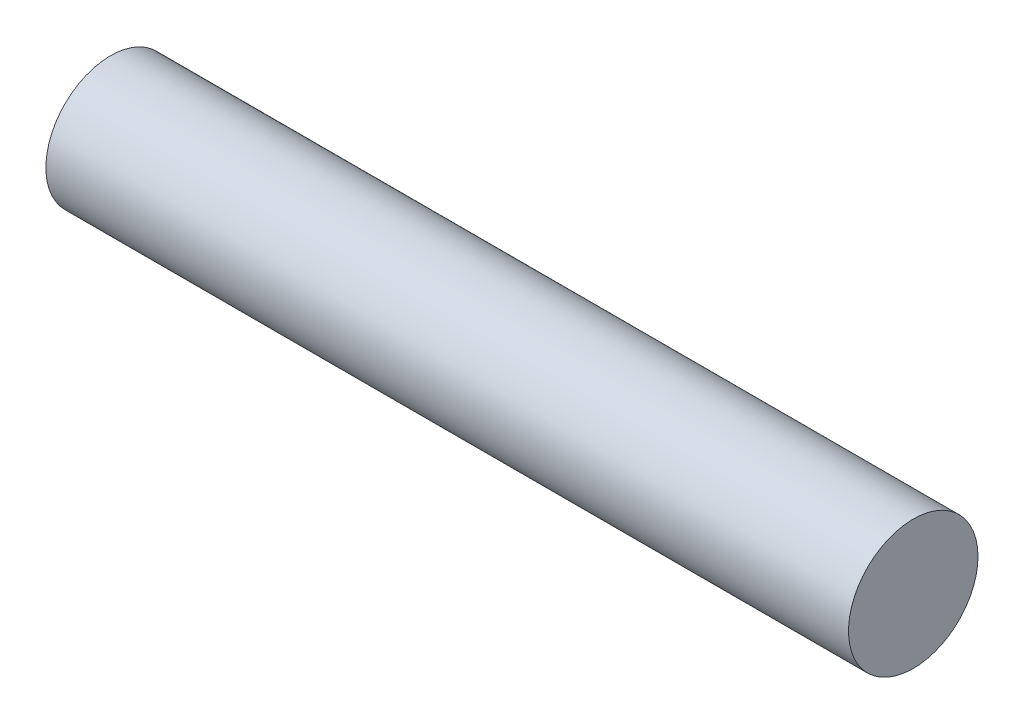
from build123d import *

# Parameters (mm, degrees)
SKETCH1_R           = 2.5
BOSS_EXTRUDE1_DEPTH = 15.5


with BuildPart() as part:
    # Sketch1 → Boss-Extrude1 (new, symmetric)
    with BuildSketch(Plane(origin=(0, 0, 0), x_dir=(0, 0, -1), z_dir=(1, 0, 0))):
        Circle(SKETCH1_R)
    extrude(amount=BOSS_EXTRUDE1_DEPTH, both=True)


solid = part.part
